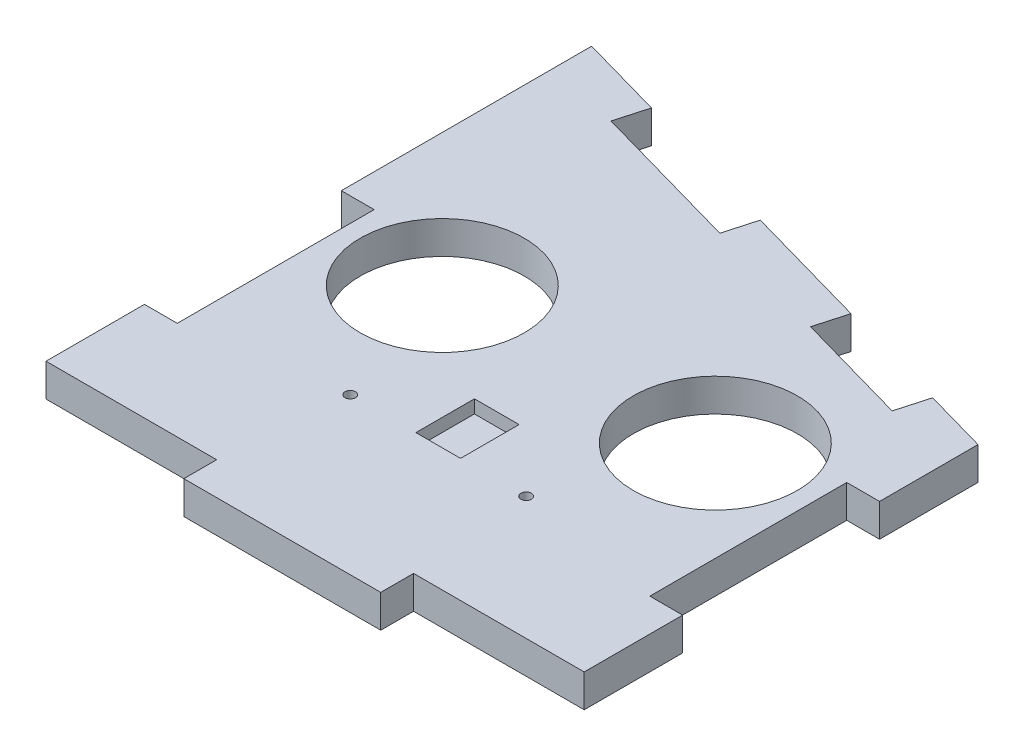
from build123d import *

# Parameters (mm, degrees)
SKETCH1_R           = 7.9375
BOSS_EXTRUDE1_DEPTH = 3.175
SKETCH2_W           = 4.318
SKETCH2_H           = 5.6642
CUT_EXTRUDE1_DEPTH  = 1.27
SKETCH3_R           = 0.508
CUT_EXTRUDE2_DEPTH  = 75.215587445


with BuildPart() as part:
    # Sketch1 → Boss-Extrude1 (new body)
    with BuildSketch(Plane(origin=(0, 0, 0), x_dir=(1, 0, 0), z_dir=(0, 1, 0))):
        Polygon((0, 0), (16.51, 0), (16.51, -3.175), (35.56, -3.175), (35.56, 0), (52.07, 0), (52.07, 9.525), (48.895, 9.525), (48.895, 28.575), (52.07, 28.575), (52.07, 38.1), (45.958497653, 39.823960283), (45.096517511, 36.768209109), (34.095813286, 39.871337619), (34.957793427, 42.927088793), (22.734788732, 46.375009359), (21.872808591, 43.319258185), (7.205202957, 47.456762864), (8.067183099, 50.512514038), (0, 52.788141612), (0, 28.575), (3.175, 28.575), (3.175, 9.525), (0, 9.525), align=None)
        with Locations(Location((12.827, 25.512426191, 0), (0, 0, 270))):
            Circle(SKETCH1_R, mode=Mode.SUBTRACT)
        with Locations(Location((39.243, 25.512426191, 0), (0, 0, 270))):
            Circle(SKETCH1_R, mode=Mode.SUBTRACT)
    extrude(amount=BOSS_EXTRUDE1_DEPTH)

    # Sketch2 → Cut-Extrude1 (cut)
    with BuildSketch(Plane(origin=(0, 3.175, 0), x_dir=(1, 0, 0), z_dir=(0, 1, 0))):
        with Locations((26.035, 14.742826191)):
            Rectangle(SKETCH2_W, SKETCH2_H)
    extrude(amount=-CUT_EXTRUDE1_DEPTH, mode=Mode.SUBTRACT)

    # Sketch3 → Cut-Extrude2 (cut, through all)
    with BuildSketch(Plane(origin=(0, 3.175, 0), x_dir=(1, 0, 0), z_dir=(0, 1, 0))):
        with Locations(Location((17.526, 11.910726191, 0), (0, 0, 270))):
            Circle(SKETCH3_R)
        with Locations(Location((34.544, 11.910726191, 0), (0, 0, 270))):
            Circle(SKETCH3_R)
    extrude(amount=-CUT_EXTRUDE2_DEPTH, mode=Mode.SUBTRACT)


solid = part.part
